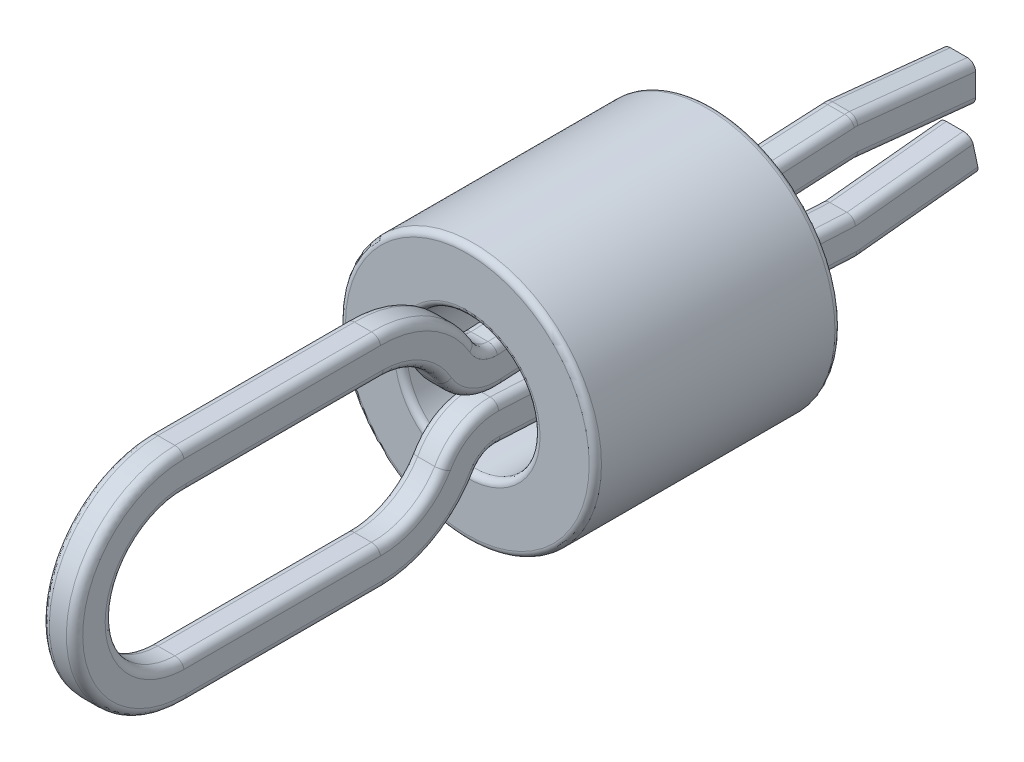
from build123d import *

# Parameters (mm, degrees)
SKETCH1_R          = 1.5875
SKETCH1_R_2        = 0.8255
PLASTIC_RING_DEPTH = 3.048
FILLET1_R          = 0.0762


with BuildPart() as part:
    # Sketch1 → Plastic-Ring (new body)
    with BuildSketch(Plane.XY):
        with Locations(Location((0, 0, 0), (0, 0, 180))):
            Circle(SKETCH1_R)
        with Locations(Location((0, 0, 0), (0, 0, 180))):
            Circle(SKETCH1_R_2, mode=Mode.SUBTRACT)
    extrude(amount=PLASTIC_RING_DEPTH)

    # Fillet1
    fillet1_edges = [part.edges().sort_by_distance(p)[0] for p in [
        (1.5875, 0, 0),
        (1.5875, 0, 3.048),
        (0.8255, 0, 0),
        (0.8255, 0, 3.048),
    ]]
    fillet(fillet1_edges, radius=FILLET1_R)


with BuildPart() as body_2:
    # Sweep3: sweep along a path in wire-bend
    with BuildLine(Plane(origin=(0, 0, 0), x_dir=(0, 0, -1), z_dir=(1, 0, 0))) as sweep3_path:
        Line((3.048, 0.381), (1.584583311, 0.532387933))
        ThreePointArc((1.584583311, 0.532387933), (1.574790193, 0.53301984), (1.564977521, 0.532893696))
        Line((1.564977521, 0.532893696), (-2.860117728, 0.3048))
        ThreePointArc((-2.860117728, 0.3048), (-3.136307543, 0.367482659), (-3.339131486, 0.56515))
        ThreePointArc((-3.339131486, 0.56515), (-3.75285, 0.978868514), (-4.318, 1.1303))
        Line((-4.318, 1.1303), (-6.7564, 1.1303))
        ThreePointArc((-6.7564, 1.1303), (-7.8867, 0), (-6.7564, -1.1303))
        Line((-6.7564, -1.1303), (-4.318, -1.1303))
        ThreePointArc((-4.318, -1.1303), (-3.75285, -0.978868514), (-3.339131486, -0.56515))
        ThreePointArc((-3.339131486, -0.56515), (-3.136307543, -0.367482659), (-2.860117728, -0.3048))
        Line((-2.860117728, -0.3048), (1.564977521, -0.532893696))
        ThreePointArc((1.564977521, -0.532893696), (1.574790193, -0.53301984), (1.584583311, -0.532387933))
        Line((1.584583311, -0.532387933), (3.048, -0.381))
    # wire-profile → Sweep3 (sweep)
    with BuildSketch(Plane.XY.offset(-3.048)):
        with BuildLine():
            Line((-0.10541, 0.6223), (0.10541, 0.6223))
            ThreePointArc((0.10541, 0.6223), (0.177252049, 0.592542049), (0.20701, 0.5207))
            Line((0.20701, 0.5207), (0.20701, 0.2413))
            ThreePointArc((0.20701, 0.2413), (0.177252049, 0.169457951), (0.10541, 0.1397))
            Line((0.10541, 0.1397), (-0.10541, 0.1397))
            ThreePointArc((-0.10541, 0.1397), (-0.177252049, 0.169457951), (-0.20701, 0.2413))
            Line((-0.20701, 0.2413), (-0.20701, 0.5207))
            ThreePointArc((-0.20701, 0.5207), (-0.177252049, 0.592542049), (-0.10541, 0.6223))
        make_face()
    sweep(path=sweep3_path.line)


solid = Compound([part.part, body_2.part])
